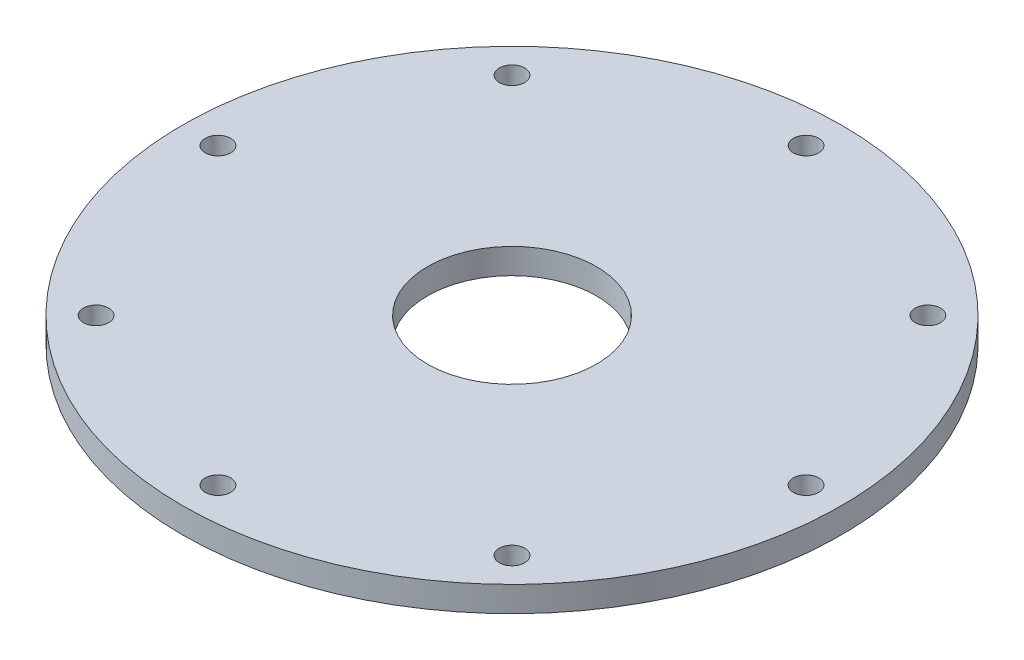
from build123d import *

# Parameters (mm, degrees)
SKETCH_1_R          = 195
SKETCH_1_R_2        = 50
EXTRUDE_1_DEPTH     = 15
CUT_EXTRUDE_1_REACH = 278.179
SKETCH_2_R          = 7.5


with BuildPart() as part:
    # 草图1 → 凸台-拉伸1 (new body)
    with BuildSketch(Plane(origin=(0, 0, 0), x_dir=(1, 0, 0), z_dir=(0, 1, 0))):
        with Locations(Location((0, 0, 0), (0, 0, 270))):
            Circle(SKETCH_1_R)
        with Locations(Location((0, 0, 0), (0, 0, 270))):
            Circle(SKETCH_1_R_2, mode=Mode.SUBTRACT)
    extrude(amount=EXTRUDE_1_DEPTH)

    # 草图2 → 切除-拉伸1 (cut, up to next)
    with BuildSketch(Plane(origin=(0, 15, 0), x_dir=(1, 0, 0), z_dir=(0, 1, 0)), mode=Mode.PRIVATE) as cut_extrude_1_sk1:
        with Locations(Location((-174, 0, 0), (0, 0, 270))):
            Circle(SKETCH_2_R)
    cut_extrude_1_tool1 = extrude(cut_extrude_1_sk1.sketch, amount=-CUT_EXTRUDE_1_REACH, mode=Mode.PRIVATE) & part.part
    # 草图2 → 切除-拉伸1 (cut, up to next)
    with BuildSketch(Plane(origin=(0, 15, 0), x_dir=(1, 0, 0), z_dir=(0, 1, 0)), mode=Mode.PRIVATE) as cut_extrude_1_sk2:
        with Locations(Location((-123.036579926, 123.036579926, 0), (0, 0, 270))):
            Circle(SKETCH_2_R)
    cut_extrude_1_tool2 = extrude(cut_extrude_1_sk2.sketch, amount=-CUT_EXTRUDE_1_REACH, mode=Mode.PRIVATE) & part.part
    # 草图2 → 切除-拉伸1 (cut, up to next)
    with BuildSketch(Plane(origin=(0, 15, 0), x_dir=(1, 0, 0), z_dir=(0, 1, 0)), mode=Mode.PRIVATE) as cut_extrude_1_sk3:
        with Locations(Location((0, 174, 0), (0, 0, 270))):
            Circle(SKETCH_2_R)
    cut_extrude_1_tool3 = extrude(cut_extrude_1_sk3.sketch, amount=-CUT_EXTRUDE_1_REACH, mode=Mode.PRIVATE) & part.part
    # 草图2 → 切除-拉伸1 (cut, up to next)
    with BuildSketch(Plane(origin=(0, 15, 0), x_dir=(1, 0, 0), z_dir=(0, 1, 0)), mode=Mode.PRIVATE) as cut_extrude_1_sk4:
        with Locations(Location((123.036579926, 123.036579926, 0), (0, 0, 270))):
            Circle(SKETCH_2_R)
    cut_extrude_1_tool4 = extrude(cut_extrude_1_sk4.sketch, amount=-CUT_EXTRUDE_1_REACH, mode=Mode.PRIVATE) & part.part
    # 草图2 → 切除-拉伸1 (cut, up to next)
    with BuildSketch(Plane(origin=(0, 15, 0), x_dir=(1, 0, 0), z_dir=(0, 1, 0)), mode=Mode.PRIVATE) as cut_extrude_1_sk5:
        with Locations(Location((174, 0, 0), (0, 0, 270))):
            Circle(SKETCH_2_R)
    cut_extrude_1_tool5 = extrude(cut_extrude_1_sk5.sketch, amount=-CUT_EXTRUDE_1_REACH, mode=Mode.PRIVATE) & part.part
    # 草图2 → 切除-拉伸1 (cut, up to next)
    with BuildSketch(Plane(origin=(0, 15, 0), x_dir=(1, 0, 0), z_dir=(0, 1, 0)), mode=Mode.PRIVATE) as cut_extrude_1_sk6:
        with Locations(Location((123.036579926, -123.036579926, 0), (0, 0, 270))):
            Circle(SKETCH_2_R)
    cut_extrude_1_tool6 = extrude(cut_extrude_1_sk6.sketch, amount=-CUT_EXTRUDE_1_REACH, mode=Mode.PRIVATE) & part.part
    # 草图2 → 切除-拉伸1 (cut, up to next)
    with BuildSketch(Plane(origin=(0, 15, 0), x_dir=(1, 0, 0), z_dir=(0, 1, 0)), mode=Mode.PRIVATE) as cut_extrude_1_sk7:
        with Locations(Location((0, -174, 0), (0, 0, 270))):
            Circle(SKETCH_2_R)
    cut_extrude_1_tool7 = extrude(cut_extrude_1_sk7.sketch, amount=-CUT_EXTRUDE_1_REACH, mode=Mode.PRIVATE) & part.part
    # 草图2 → 切除-拉伸1 (cut, up to next)
    with BuildSketch(Plane(origin=(0, 15, 0), x_dir=(1, 0, 0), z_dir=(0, 1, 0)), mode=Mode.PRIVATE) as cut_extrude_1_sk8:
        with Locations(Location((-123.036579926, -123.036579926, 0), (0, 0, 270))):
            Circle(SKETCH_2_R)
    cut_extrude_1_tool8 = extrude(cut_extrude_1_sk8.sketch, amount=-CUT_EXTRUDE_1_REACH, mode=Mode.PRIVATE) & part.part
    add(cut_extrude_1_tool1.solids().sort_by_distance((-174, 15, 0))[0], mode=Mode.SUBTRACT)
    add(cut_extrude_1_tool2.solids().sort_by_distance((-123.03658, 15, -123.03658))[0], mode=Mode.SUBTRACT)
    add(cut_extrude_1_tool3.solids().sort_by_distance((0, 15, -174))[0], mode=Mode.SUBTRACT)
    add(cut_extrude_1_tool4.solids().sort_by_distance((123.03658, 15, -123.03658))[0], mode=Mode.SUBTRACT)
    add(cut_extrude_1_tool5.solids().sort_by_distance((174, 15, 0))[0], mode=Mode.SUBTRACT)
    add(cut_extrude_1_tool6.solids().sort_by_distance((123.03658, 15, 123.03658))[0], mode=Mode.SUBTRACT)
    add(cut_extrude_1_tool7.solids().sort_by_distance((0, 15, 174))[0], mode=Mode.SUBTRACT)
    add(cut_extrude_1_tool8.solids().sort_by_distance((-123.03658, 15, 123.03658))[0], mode=Mode.SUBTRACT)


solid = part.part
